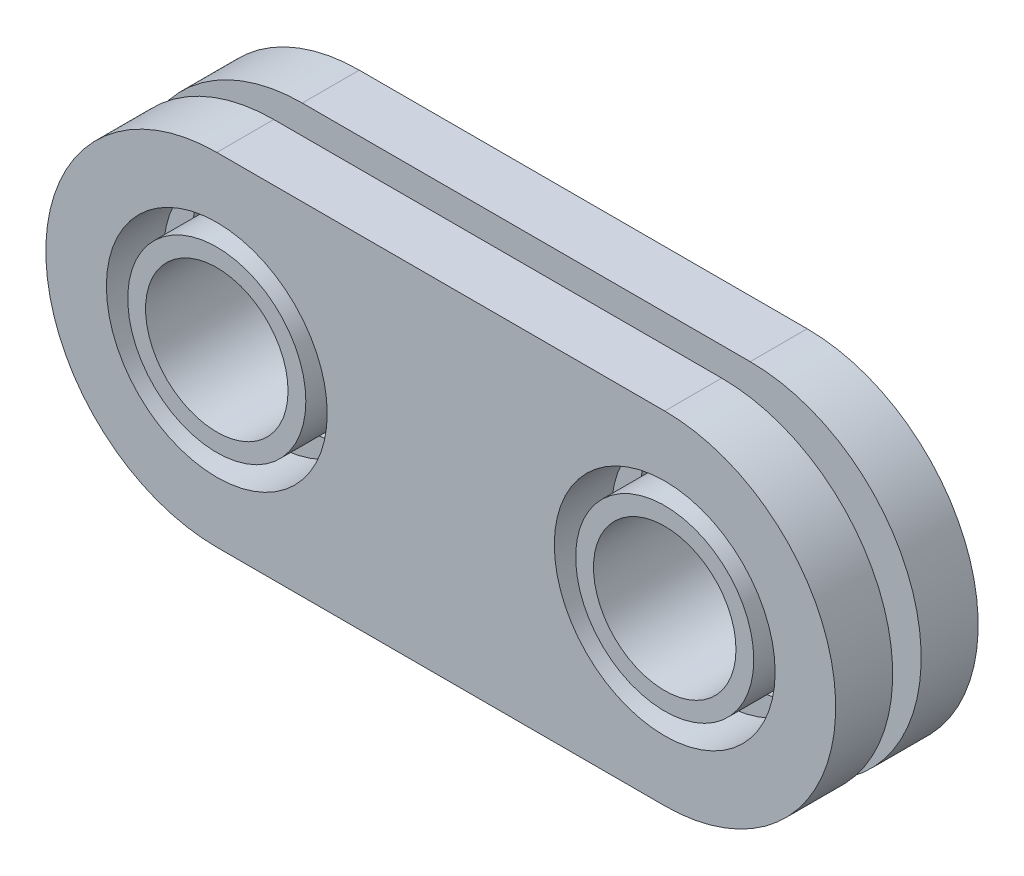
from build123d import *

# Parameters (mm, degrees)
BOSS_EXTRUDE1_START   = 0.2
SKETCH1_R             = 1.55
BOSS_EXTRUDE1_DEPTH   = 0.8
BOSS_EXTRUDE2_START   = -1
SKETCH2_R             = 1.55
BOSS_EXTRUDE2_DEPTH   = 0.8
BOSS_EXTRUDE3_START   = -1
SKETCH3_R             = 1.25
SKETCH3_R_2           = 1
BOSS_EXTRUDE3_DEPTH   = 2
BOSS_EXTRUDE3_2_DEPTH = 2


with BuildPart() as part:
    # Sketch1 → Boss-Extrude1 (new body)
    with BuildSketch(Plane.XY.offset(BOSS_EXTRUDE1_START)):
        with BuildLine():
            Line((0, -2.4), (6.287642552, -2.4))
            ThreePointArc((6.287642552, -2.4), (8.687642552, 0), (6.287642552, 2.4))
            Line((6.287642552, 2.4), (0, 2.4))
            ThreePointArc((0, 2.4), (-2.4, 0), (0, -2.4))
        make_face()
        Circle(SKETCH1_R, mode=Mode.SUBTRACT)
        with Locations((6.287642552, 0)):
            Circle(SKETCH1_R, mode=Mode.SUBTRACT)
    extrude(amount=BOSS_EXTRUDE1_DEPTH)


with BuildPart() as body_2:
    # Sketch2 → Boss-Extrude2 (new body)
    with BuildSketch(Plane.XY.offset(BOSS_EXTRUDE2_START)):
        with BuildLine():
            Line((0, -2.4), (6.287642552, -2.4))
            ThreePointArc((6.287642552, -2.4), (8.687642552, 0), (6.287642552, 2.4))
            Line((6.287642552, 2.4), (0, 2.4))
            ThreePointArc((0, 2.4), (-2.4, 0), (0, -2.4))
        make_face()
        Circle(SKETCH2_R, mode=Mode.SUBTRACT)
        with Locations((6.287642552, 0)):
            Circle(SKETCH2_R, mode=Mode.SUBTRACT)
    extrude(amount=BOSS_EXTRUDE2_DEPTH)


with BuildPart() as body_3:
    # Sketch3 → Boss-Extrude3 (new body)
    with BuildSketch(Plane.XY.offset(BOSS_EXTRUDE3_START)):
        Circle(SKETCH3_R)
        Circle(SKETCH3_R_2, mode=Mode.SUBTRACT)
    extrude(amount=BOSS_EXTRUDE3_DEPTH)


with BuildPart() as body_4:
    # Sketch3 → Boss-Extrude3 2 (new body)
    with BuildSketch(Plane.XY.offset(BOSS_EXTRUDE3_START)):
        with Locations((6.287642552, 0)):
            Circle(SKETCH3_R)
        with Locations((6.287642552, 0)):
            Circle(SKETCH3_R_2, mode=Mode.SUBTRACT)
    extrude(amount=BOSS_EXTRUDE3_2_DEPTH)


solid = Compound([part.part, body_2.part, body_3.part, body_4.part])
